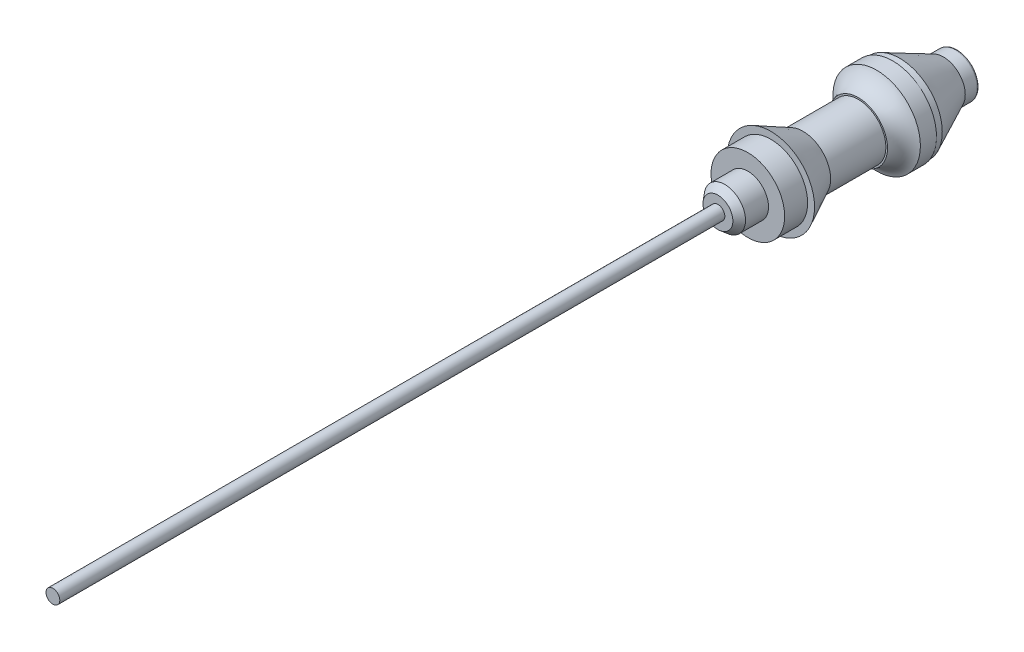
from build123d import *


with BuildPart() as part:
    # Эскиз1 → Повернуть1 (revolve)
    with BuildSketch(Plane(origin=(0, 0, 0), x_dir=(0, 0, -1), z_dir=(1, 0, 0)), mode=Mode.PRIVATE) as revolve_1_sk:
        with BuildLine():
            Line((0, 0), (0, 3))
            Line((0, 3), (289, 3))
            Line((289, 3), (289, 6.5))
            Line((289, 6.5), (291.999073931, 9))
            Line((291.999073931, 9), (301.999073931, 9))
            Line((301.999073931, 9), (301.999073931, 16))
            Line((301.999073931, 16), (311.999073931, 16))
            Line((311.999073931, 16), (311.999073931, 19))
            Line((311.999073931, 19), (325.999073931, 12))
            Line((325.999073931, 12), (349.999073931, 12))
            Line((349.999073931, 12), (349.999073931, 12.7))
            ThreePointArc((349.999073931, 12.7), (354.861013139, 14.755474022), (357.999073931, 19))
            Line((357.999073931, 19), (365, 19))
            Line((365, 19), (365, 18.5))
            Line((365, 18.5), (368, 18.5))
            Line((368, 18.5), (387, 9.5))
            Line((387, 9.5), (392.2, 9.5))
            ThreePointArc((392.2, 9.5), (392.765685425, 9.265685425), (393, 8.7))
            Line((393, 8.7), (393, 0))
            Line((393, 0), (0, 0))
        make_face()
    revolve(revolve_1_sk.sketch.rotate(Axis((0, 0, 0), (0, 0, -1)), 90), axis=Axis((0, 0, 0), (0, 0, -1)))


solid = part.part
